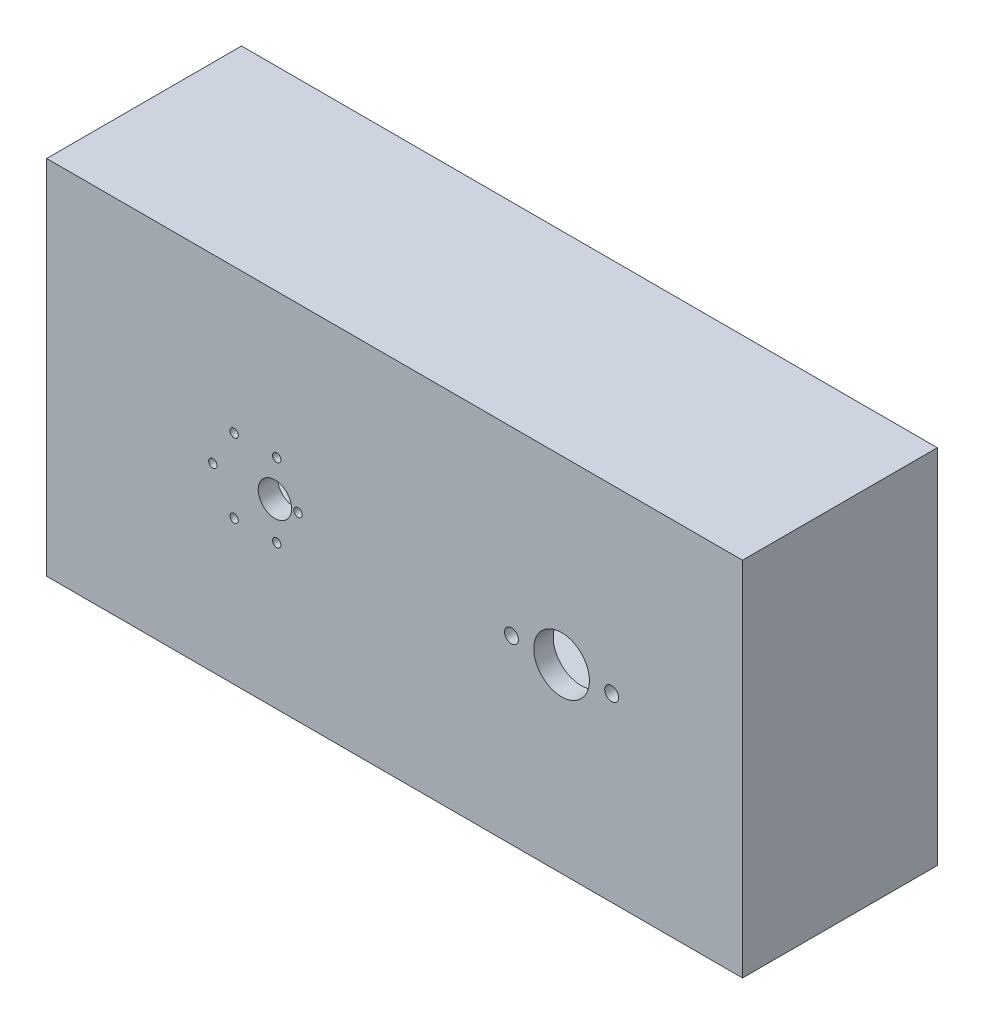
from build123d import *

# Parameters (mm, degrees)
SKETCH1_W           = 250
SKETCH1_H           = 130
BOSS_EXTRUDE1_DEPTH = 70
SHELL1_T            = -7
SKETCH2_R           = 10
SKETCH2_R_2         = 2.5
SKETCH2_R_3         = 1.5
SKETCH2_R_4         = 6
CUT_EXTRUDE1_DEPTH  = 90


with BuildPart() as part:
    # Sketch1 → Boss-Extrude1 (new body)
    with BuildSketch(Plane.XY):
        Rectangle(SKETCH1_W, SKETCH1_H)
    extrude(amount=BOSS_EXTRUDE1_DEPTH)

    # Shell1
    shell1_openings = [part.faces().sort_by_distance(p)[0] for p in [
        (0, 0, 0),
    ]]
    offset(amount=SHELL1_T, openings=shell1_openings, kind=Kind.INTERSECTION)

    # Sketch2 → Cut-Extrude1 (cut)
    with BuildSketch(Plane.XY.offset(70)):
        with Locations((60, 0)):
            Circle(SKETCH2_R)
        with Locations((42, 0)):
            Circle(SKETCH2_R_2)
        with Locations((78, 0)):
            Circle(SKETCH2_R_2)
        with Locations((-34.7, 0)):
            Circle(SKETCH2_R_3)
        with Locations((-42.35, -13.250188678)):
            Circle(SKETCH2_R_3)
        with Locations((-57.65, -13.250188678)):
            Circle(SKETCH2_R_3)
        with Locations((-65.3, 0)):
            Circle(SKETCH2_R_3)
        with Locations((-57.65, 13.250188678)):
            Circle(SKETCH2_R_3)
        with Locations((-42.35, 13.250188678)):
            Circle(SKETCH2_R_3)
        with Locations((-43, 0)):
            Circle(SKETCH2_R_4)
    extrude(amount=-CUT_EXTRUDE1_DEPTH, mode=Mode.SUBTRACT)


solid = part.part
